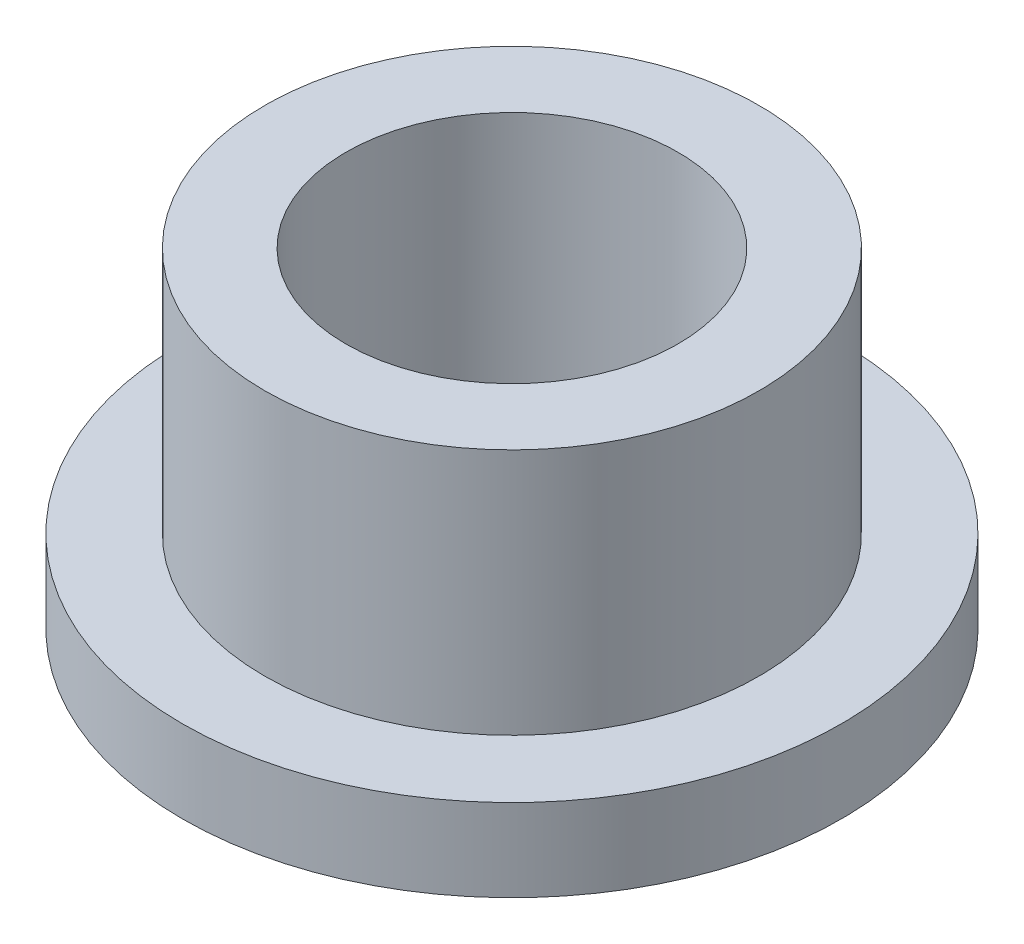
from build123d import *

# Parameters (mm, degrees)
SKETCH2_R           = 4.7625
SKETCH2_R_2         = 3.2004
BOSS_EXTRUDE1_DEPTH = 6.35
SKETCH3_R           = 6.35
SKETCH3_R_2         = 4.7625
BOSS_EXTRUDE2_DEPTH = 1.5875


with BuildPart() as part:
    # Sketch2 → Boss-Extrude1 (new body)
    with BuildSketch(Plane(origin=(0, 0, 0), x_dir=(1, 0, 0), z_dir=(0, 1, 0))):
        with Locations(Location((0, 0, 0), (0, 0, 270))):
            Circle(SKETCH2_R)
        with Locations(Location((0, 0, 0), (0, 0, 270))):
            Circle(SKETCH2_R_2, mode=Mode.SUBTRACT)
    extrude(amount=BOSS_EXTRUDE1_DEPTH)

    # Sketch3 → Boss-Extrude2 (add)
    with BuildSketch(Plane(origin=(0, 0, 0), x_dir=(1, 0, 0), z_dir=(0, 1, 0))):
        with Locations(Location((0, 0, 0), (0, 0, 270))):
            Circle(SKETCH3_R)
        with Locations(Location((0, 0, 0), (0, 0, 270))):
            Circle(SKETCH3_R_2, mode=Mode.SUBTRACT)
    extrude(amount=BOSS_EXTRUDE2_DEPTH)


solid = part.part
